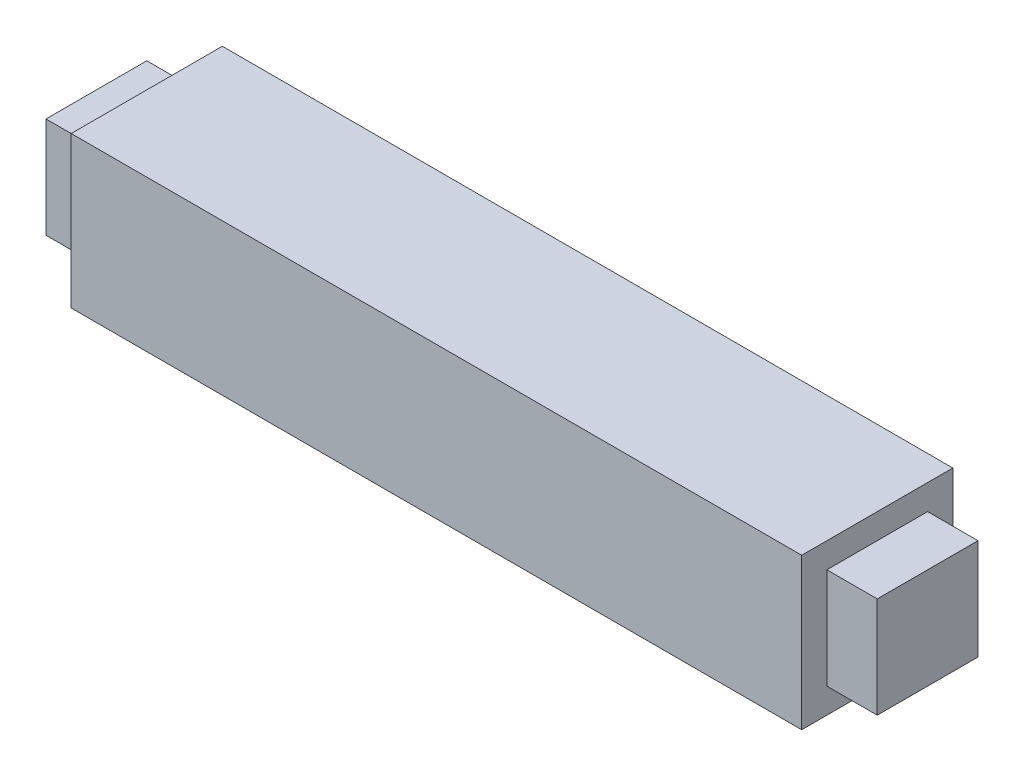
from build123d import *

# Parameters (mm, degrees)
SKETCH1_W           = 145
SKETCH1_H           = 30
BOSS_EXTRUDE1_DEPTH = 15
SKETCH2_W           = 20
SKETCH2_H           = 20
BOSS_EXTRUDE2_DEPTH = 10
SKETCH3_W           = 20
SKETCH3_H           = 20
BOSS_EXTRUDE3_DEPTH = 10


with BuildPart() as part:
    # Sketch1 → Boss-Extrude1 (new, symmetric)
    with BuildSketch(Plane.XY):
        Rectangle(SKETCH1_W, SKETCH1_H)
    extrude(amount=BOSS_EXTRUDE1_DEPTH, both=True)

    # Sketch2 → Boss-Extrude2 (add)
    with BuildSketch(Plane(origin=(72.5, 0, 0), x_dir=(0, 0, -1), z_dir=(1, 0, 0))):
        Rectangle(SKETCH2_W, SKETCH2_H)
    extrude(amount=BOSS_EXTRUDE2_DEPTH)

    # Sketch3 → Boss-Extrude3 (add)
    with BuildSketch(Plane.ZY.offset(72.5)):
        Rectangle(SKETCH3_W, SKETCH3_H)
    extrude(amount=BOSS_EXTRUDE3_DEPTH)


solid = part.part
